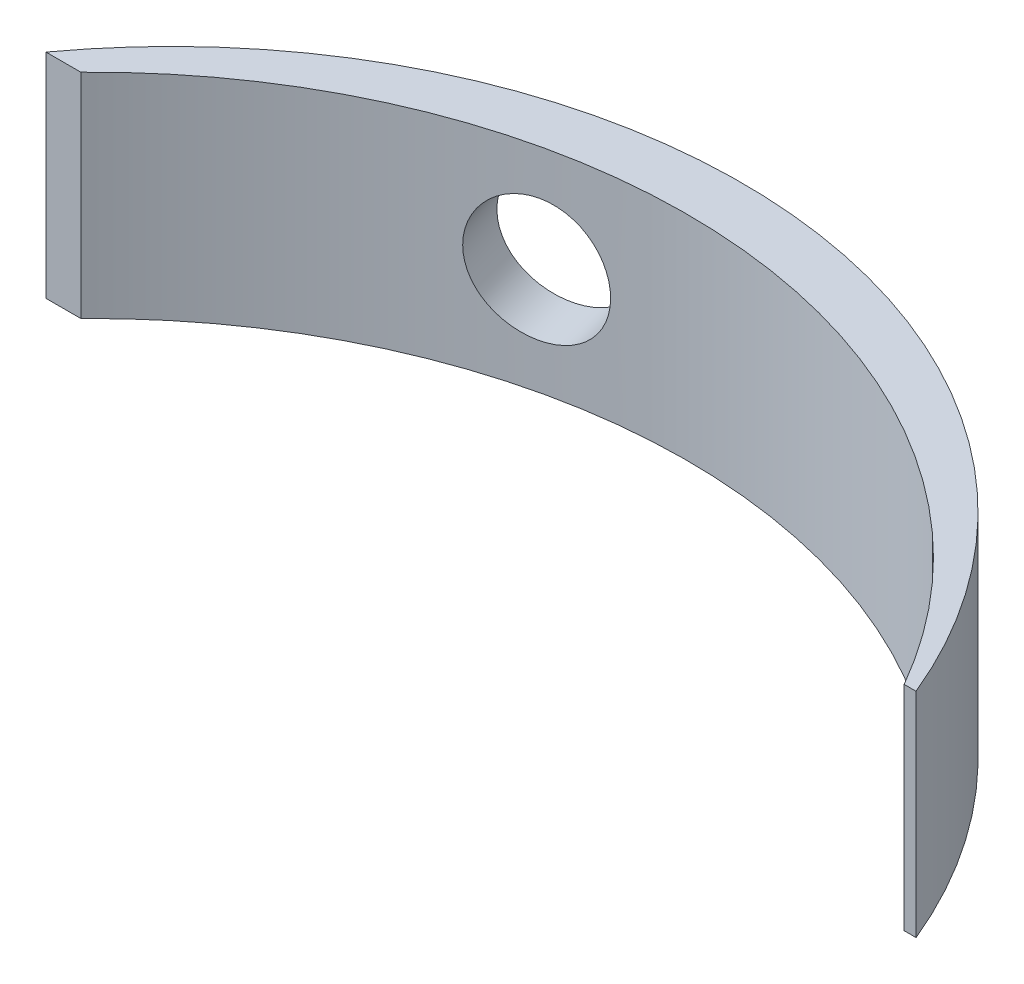
from build123d import *

# Parameters (mm, degrees)
BOSS_EXTRUDE1_DEPTH = 57.15
SKETCH4_R           = 16.51
CUT_EXTRUDE1_DEPTH  = 310.020008061
SKETCH5_W           = 49.699696275
SKETCH5_H           = 31.75
CUT_EXTRUDE2_DEPTH  = 304.425034295


with BuildPart() as part:
    # Sketch1 → Boss-Extrude1 (new body)
    with BuildSketch(Plane(origin=(0, 0, 0), x_dir=(1, 0, 0), z_dir=(0, 1, 0))):
        with BuildLine():
            Line((0, 0), (3.175, 0))
            ThreePointArc((3.175, 0), (141.2875, 80.01), (279.4, 0))
            Line((279.4, 0), (282.575, 0))
            ThreePointArc((282.575, 0), (141.2875, 94.615), (0, 0))
        make_face()
    extrude(amount=BOSS_EXTRUDE1_DEPTH)

    # Sketch4 → Cut-Extrude1 (cut, through all)
    with BuildSketch(Plane(origin=(-15.966248852, 0, -55.68092686), x_dir=(-0.9612616959383227, 0, 0.275637355816986), z_dir=(-0.275637355816986, 0, -0.9612616959383227))):
        with Locations((-122.428, 28.575)):
            Circle(SKETCH4_R)
    extrude(amount=-CUT_EXTRUDE1_DEPTH, mode=Mode.SUBTRACT)

    # Sketch5 → Cut-Extrude2 (cut, through all)
    with BuildSketch(Plane(origin=(0, 0, 0), x_dir=(1, 0, 0), z_dir=(0, 1, 0))):
        with Locations((24.849848138, 15.875)):
            Rectangle(SKETCH5_W, SKETCH5_H)
    extrude(amount=CUT_EXTRUDE2_DEPTH, mode=Mode.SUBTRACT)


solid = part.part
